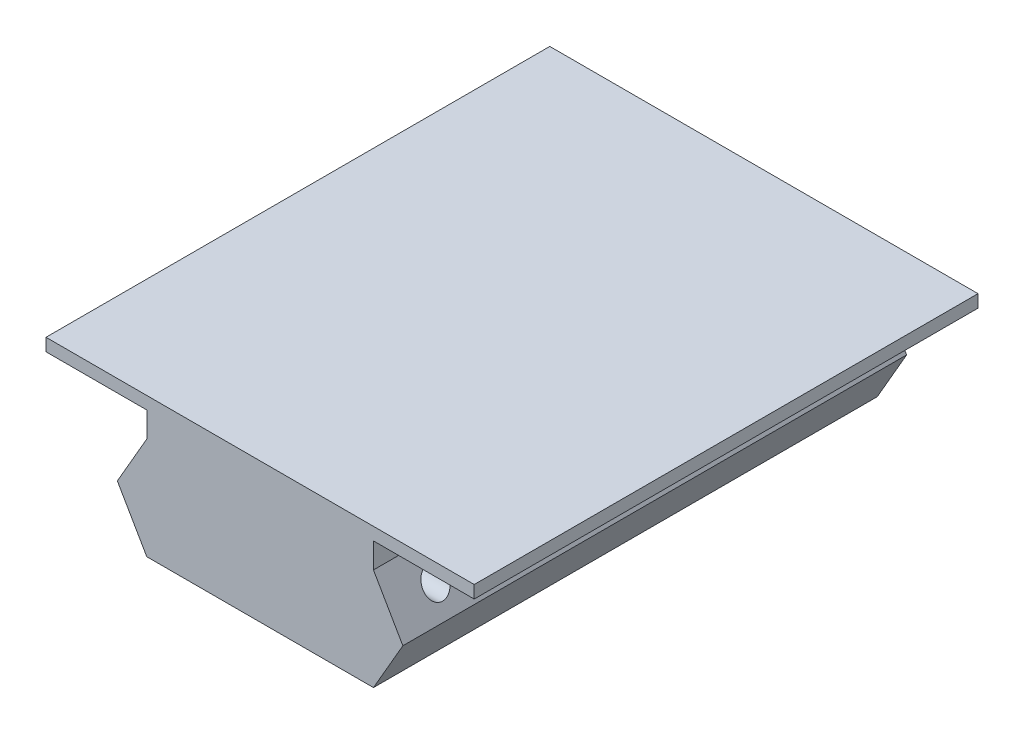
from build123d import *

# Parameters (mm, degrees)
BOSS_EXTRUDE1_DEPTH = 40
SKETCH2_R           = 1
CUT_EXTRUDE1_DEPTH  = 46.122068075
LPATTERN1_COUNT     = 10
LPATTERN1_PITCH     = 3.71


with BuildPart() as part:
    # Sketch1 → Boss-Extrude1 (new body)
    with BuildSketch(Plane.XY):
        Polygon((9.693000417, 0), (-8.306999583, 0), (-10.641999583, 4.044338636), (-8.306999583, 8.088677271), (-8.306999583, 10.088677271), (-16.306999583, 10.088677271), (-16.306999583, 11.088677271), (17.693000417, 11.088677271), (17.693000417, 10.088677271), (9.693000417, 10.088677271), (9.693000417, 8.088677271), (12.028000417, 4.044338636), align=None)
    extrude(amount=-BOSS_EXTRUDE1_DEPTH)

    # Sketch2 → Cut-Extrude1 (cut, symmetric)
    with BuildSketch(Plane(origin=(0, 0, 0), x_dir=(0, 0, -1), z_dir=(1, 0, 0))):
        with Locations(Location((3.71, 5.988677271, 0), (0, 0, 90))):
            Circle(SKETCH2_R)
    cut_extrude1 = extrude(amount=CUT_EXTRUDE1_DEPTH, both=True, mode=Mode.SUBTRACT)

    # LPattern1: Cut-Extrude1 ×10
    with Locations(*[(0, 0, -i * LPATTERN1_PITCH) for i in range(1, LPATTERN1_COUNT)]):
        add(cut_extrude1, mode=Mode.SUBTRACT)


solid = part.part
